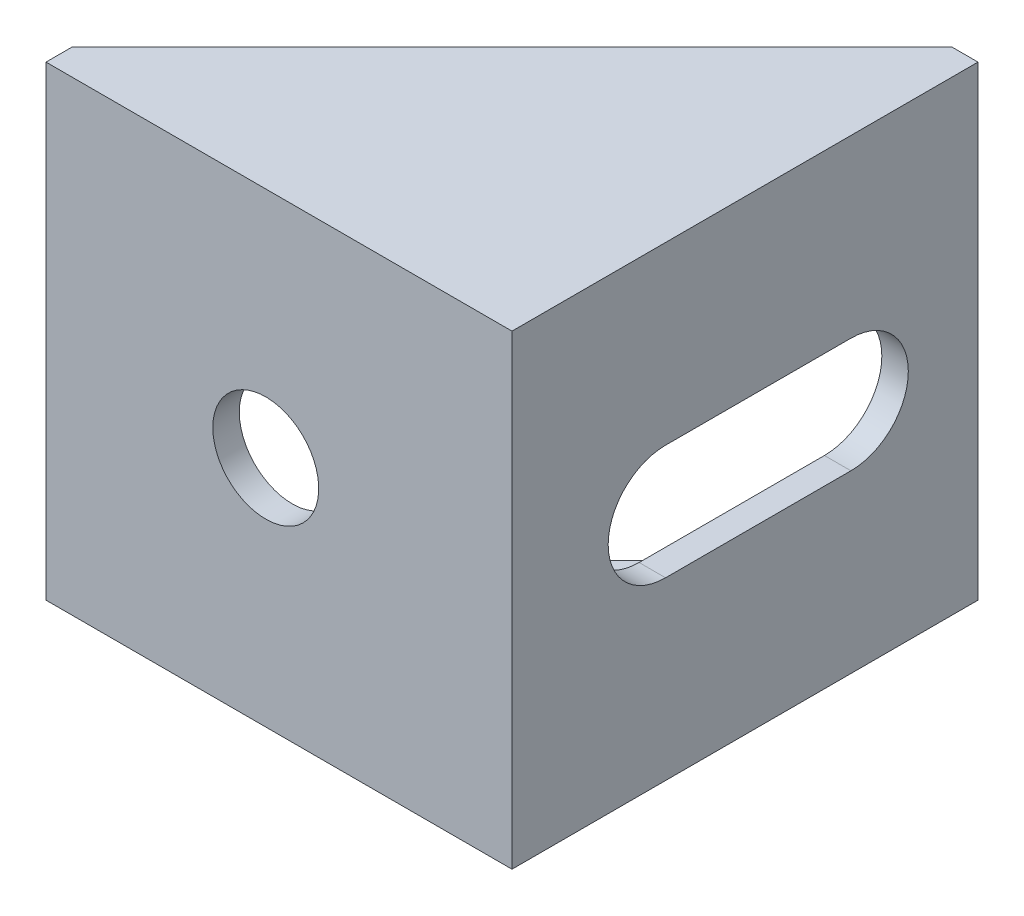
from build123d import *

# Parameters (mm, degrees)
BOSS_EXTRUDE1_DEPTH = 25.4
BOSS_EXTRUDE2_DEPTH = 1.27
BOSS_EXTRUDE3_DEPTH = 1.27
CUT_EXTRUDE1_DEPTH  = 47.758814744
SKETCH5_R           = 3.175
CUT_EXTRUDE2_DEPTH  = 47.758814744


with BuildPart() as part:
    # Sketch1 → Boss-Extrude1 (new body)
    with BuildSketch(Plane(origin=(0, 0, 0), x_dir=(1, 0, 0), z_dir=(0, 1, 0))):
        Polygon((-27.94, 1.5875), (-1.5875, 1.5875), (-1.5875, 27.94), (0, 27.94), (0, 0), (-27.94, 0), align=None)
    extrude(amount=BOSS_EXTRUDE1_DEPTH)

    # Sketch2 → Boss-Extrude2 (add)
    with BuildSketch(Plane(origin=(0, 25.4, 0), x_dir=(1, 0, 0), z_dir=(0, 1, 0))):
        Polygon((-1.5875, 27.94), (-27.94, 1.5875), (-27.94, 0), (0, 0), (0, 27.94), align=None)
    extrude(amount=BOSS_EXTRUDE2_DEPTH)

    # Sketch3 → Boss-Extrude3 (add)
    with BuildSketch(Plane.XZ):
        Polygon((-27.94, -1.5875), (-1.5875, -27.94), (0, -27.94), (0, 0), (-27.94, 0), align=None)
    extrude(amount=BOSS_EXTRUDE3_DEPTH)

    # Sketch4 → Cut-Extrude1 (cut, through all)
    with BuildSketch(Plane.ZY.offset(1.5875)):
        with BuildLine():
            Line((-20.32, 9.2583), (-9.2075, 9.2583))
            ThreePointArc((-9.2075, 9.2583), (-5.7658, 12.7), (-9.2075, 16.1417))
            Line((-9.2075, 16.1417), (-20.32, 16.1417))
            ThreePointArc((-20.32, 16.1417), (-23.7617, 12.7), (-20.32, 9.2583))
        make_face()
    extrude(amount=-CUT_EXTRUDE1_DEPTH, mode=Mode.SUBTRACT)

    # Sketch5 → Cut-Extrude2 (cut, through all)
    with BuildSketch(Plane(origin=(0, 0, -1.5875), x_dir=(-1, 0, 0), z_dir=(0, 0, -1))):
        with Locations((14.76375, 12.7)):
            Circle(SKETCH5_R)
    extrude(amount=-CUT_EXTRUDE2_DEPTH, mode=Mode.SUBTRACT)


solid = part.part
